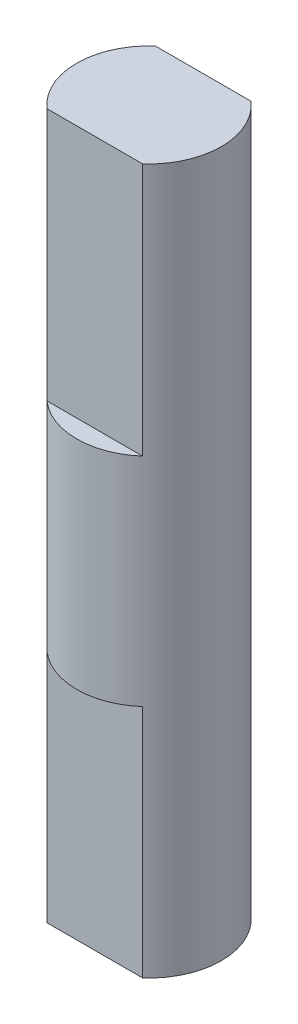
from build123d import *

# Parameters (mm, degrees)
CROQUIS1_R                   = 4
SALIENTE_EXTRUIR1_DEPTH      = 12
SALIENTE_EXTRUIR2_DEPTH      = 14
SALIENTE_EXTRUIR2_DEPTH_BACK = 25


with BuildPart() as part:
    # Croquis1 → Saliente-Extruir1 (new body)
    with BuildSketch(Plane(origin=(0, 0, 0), x_dir=(1, 0, 0), z_dir=(0, 1, 0))):
        Circle(CROQUIS1_R)
    extrude(amount=SALIENTE_EXTRUIR1_DEPTH)

    # Croquis2 → Saliente-Extruir2 (add, two sides: drawn at the far end of the back side and taken through both)
    with BuildSketch(Plane(origin=(0, 12, 0), x_dir=(1, 0, 0), z_dir=(0, 1, 0)).offset(-SALIENTE_EXTRUIR2_DEPTH_BACK)):
        with BuildLine():
            Line((-2.645751311, -3), (2.645751311, -3))
            ThreePointArc((2.645751311, -3), (4, 0), (2.645751311, 3))
            Line((2.645751311, 3), (-2.645751311, 3))
            ThreePointArc((-2.645751311, 3), (-4, 0), (-2.645751311, -3))
        make_face()
    extrude(amount=SALIENTE_EXTRUIR2_DEPTH + SALIENTE_EXTRUIR2_DEPTH_BACK)


solid = part.part
